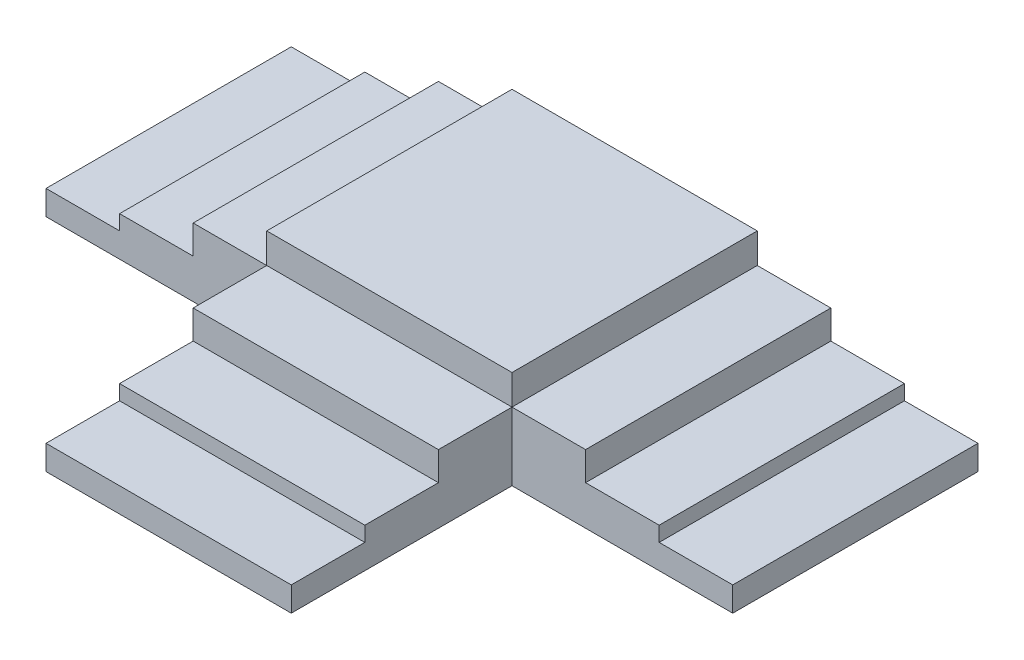
from build123d import *

# Parameters (mm, degrees)
SKETCH_1_W      = 1000
SKETCH_1_H      = 1000
EXTRUDE_1_DEPTH = 400
EXTRUDE_2_DEPTH = 1000
EXTRUDE_3_DEPTH = 1000
EXTRUDE_4_DEPTH = 1000


with BuildPart() as part:
    # 草图1 → 凸台-拉伸1 (new body)
    with BuildSketch(Plane(origin=(0, 0, 0), x_dir=(1, 0, 0), z_dir=(0, 1, 0))):
        Rectangle(SKETCH_1_W, SKETCH_1_H)
    extrude(amount=EXTRUDE_1_DEPTH)

    # 草图2 → 凸台-拉伸2 (add)
    with BuildSketch(Plane(origin=(0, 0, -500), x_dir=(-1, 0, 0), z_dir=(0, 0, -1))):
        Polygon((500, 0), (1400, 0), (1400, 100), (1100, 100), (1100, 160.854960844), (800, 160.854960844), (800, 277.753844898), (500, 277.753844898), align=None)
    extrude(amount=-EXTRUDE_2_DEPTH)

    # 草图4 → 凸台-拉伸3 (add)
    with BuildSketch(Plane.ZY.offset(500)):
        Polygon((500, 0), (1400, 0), (1400, 100), (1100, 100), (1100, 160.854960844), (800, 160.854960844), (800, 277.753844898), (500, 277.753844898), align=None)
    extrude(amount=-EXTRUDE_3_DEPTH)

    # 草图5 → 凸台-拉伸4 (add)
    with BuildSketch(Plane.XY.offset(500)):
        Polygon((500, 0), (1400, 0), (1400, 100), (1100, 100), (1100, 160.854960844), (800, 160.854960844), (800, 277.753844898), (500, 277.753844898), align=None)
    extrude(amount=-EXTRUDE_4_DEPTH)


solid = part.part
